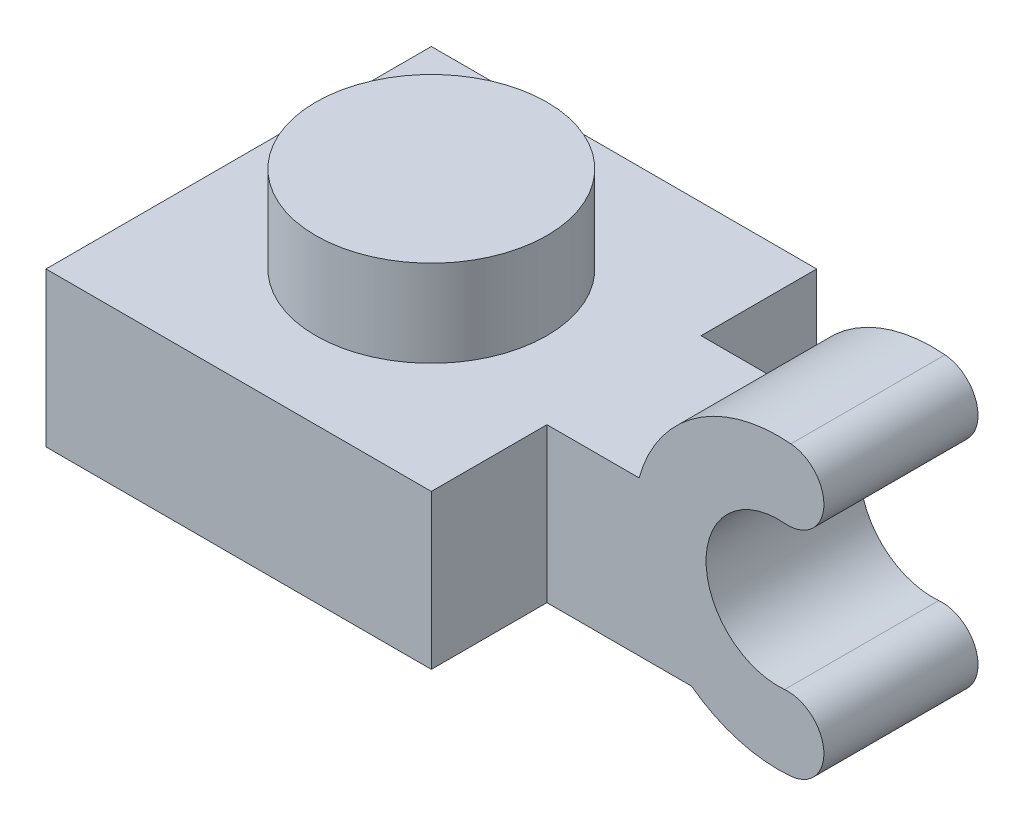
from build123d import *

# Parameters (mm, degrees)
SKETCH1_W                = 8
SKETCH1_H                = 8
BOSS_EXTRUDE1_DEPTH      = 3.2
SKETCH2_R                = 2.4
BOSS_EXTRUDE2_DEPTH      = 1.8
SKETCH3_W                = 4.8
SKETCH3_H                = 4.8
CUT_EXTRUDE1_DEPTH       = 1.8
BOSS_EXTRUDE3_DEPTH      = 1.6
BOSS_EXTRUDE3_DEPTH_BACK = 1.6


with BuildPart() as part:
    # Sketch1 → Boss-Extrude1 (new body)
    with BuildSketch(Plane(origin=(0, 0, 0), x_dir=(1, 0, 0), z_dir=(0, 1, 0))):
        with Locations((4, 4)):
            Rectangle(SKETCH1_W, SKETCH1_H)
    extrude(amount=BOSS_EXTRUDE1_DEPTH)

    # Sketch2 → Boss-Extrude2 (add)
    with BuildSketch(Plane(origin=(0, 3.2, 0), x_dir=(1, 0, 0), z_dir=(0, 1, 0))):
        with Locations((4, 4)):
            Circle(SKETCH2_R)
    extrude(amount=BOSS_EXTRUDE2_DEPTH)

    # Sketch3 → Cut-Extrude1 (cut)
    with BuildSketch(Plane.XZ):
        with Locations((4, -4)):
            Rectangle(SKETCH3_W, SKETCH3_H)
    extrude(amount=-CUT_EXTRUDE1_DEPTH, mode=Mode.SUBTRACT)

    # Sketch4 → Boss-Extrude3 (add, two sides: drawn at the far end of the back side and taken through both)
    with BuildSketch(Plane(origin=(0, 0, -4), x_dir=(-1, 0, 0), z_dir=(0, 0, -1)).offset(-BOSS_EXTRUDE3_DEPTH_BACK)):
        with BuildLine():
            Line((-8, 3.2), (-9.91253312, 3.2))
            ThreePointArc((-9.91253312, 3.2), (-11.093178218, 4.86443349), (-13.065366807, 5.388584094))
            ThreePointArc((-13.065366807, 5.388584094), (-13.747146024, 4.576071264), (-12.934633193, 3.894292047))
            ThreePointArc((-12.934633193, 3.894292047), (-11.303899579, 2.4), (-12.934633193, 0.905707953))
            ThreePointArc((-12.934633193, 0.905707953), (-13.747146024, 0.223928736), (-13.065366807, -0.588584094))
            ThreePointArc((-13.065366807, -0.588584094), (-11.98026217, -0.48472207), (-11.003899579, 0))
            Line((-11.003899579, 0), (-8, 0))
            Line((-8, 0), (-8, 3.2))
        make_face()
    extrude(amount=BOSS_EXTRUDE3_DEPTH + BOSS_EXTRUDE3_DEPTH_BACK)


solid = part.part
